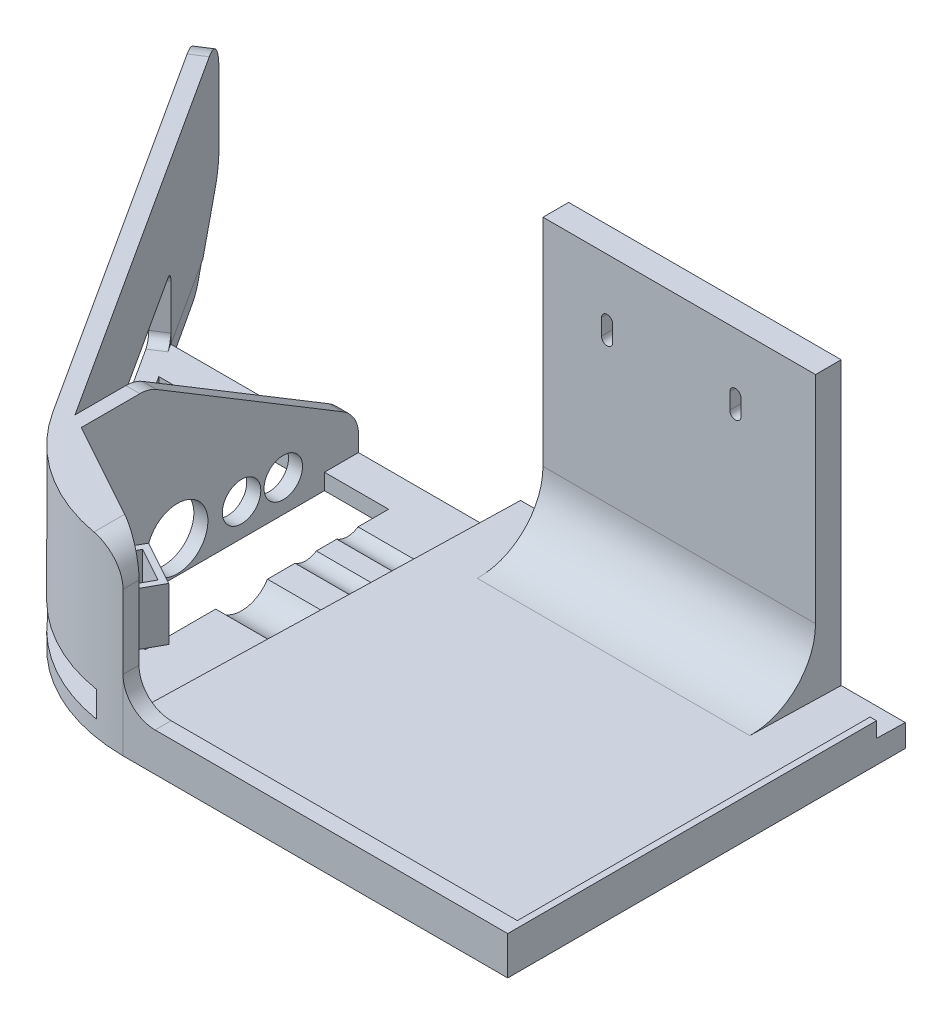
from build123d import *

# Parameters (mm, degrees)
SKETCH1_W            = 155
SKETCH1_H            = 5
BOSS_EXTRUDE2_DEPTH  = 55
SKETCH2_W            = 112
SKETCH2_H            = 45
SKETCH2_R            = 1.75
CUT_EXTRUDE1_DEPTH   = 55
SKETCH3_W            = 100
SKETCH3_H            = 20
CUT_EXTRUDE2_DEPTH   = 55
SKETCH4_W            = 40
SKETCH4_H            = 8.065867699
CUT_EXTRUDE3_DEPTH   = 55
BOSS_EXTRUDE4_DEPTH  = 5
CUT_EXTRUDE4_DEPTH   = 50
SKETCH9_W            = 4.377781836
SKETCH9_H            = 86.488706471
BOSS_EXTRUDE7_DEPTH  = 50
SKETCH10_W           = 20
SKETCH10_H           = 86.532324722
CUT_EXTRUDE5_DEPTH   = 10
SKETCH12_R           = 9.5
SKETCH12_R_2         = 6
CUT_EXTRUDE6_DEPTH   = 10
CUT_EXTRUDE7_START   = 50
SKETCH13_R           = 9.5
SKETCH13_R_2         = 6
CUT_EXTRUDE7_DEPTH   = 50
CUT_EXTRUDE8_DEPTH   = 50
CUT_EXTRUDE9_DEPTH   = 50
CUT_EXTRUDE10_DEPTH  = 10
FILLET5_R            = 3
SKETCH18_W           = 98.767816147
SKETCH18_H           = 10.604205858
BOSS_EXTRUDE8_DEPTH  = 5
CUT_EXTRUDE11_DEPTH  = 5
SKETCH20_W           = 155
SKETCH20_H           = 119
BOSS_EXTRUDE9_DEPTH  = 10
CUT_EXTRUDE13_DEPTH  = 155
SKETCH24_W           = 110
SKETCH24_H           = 8
BOSS_EXTRUDE10_DEPTH = 95
FILLET6_R            = 20
SKETCH26_W           = 16
SKETCH26_H           = 1.5
BOSS_EXTRUDE11_DEPTH = 12
BOSS_EXTRUDE12_DEPTH = 15
SKETCH28_R           = 2.5
CUT_EXTRUDE15_DEPTH  = 5
CUT_EXTRUDE17_DEPTH  = 35
SKETCH29_W           = 43
SKETCH29_H           = 43
CUT_EXTRUDE18_DEPTH  = 35
FILLET9_R            = 10
SKETCH31_W           = 124
SKETCH31_H           = 12
BOSS_EXTRUDE14_DEPTH = 2
SKETCH32_W           = 5
SKETCH32_H           = 2
BOSS_EXTRUDE15_DEPTH = 132
SKETCH33_W           = 20
SKETCH33_H           = 12
CUT_EXTRUDE19_DEPTH  = 160
SKETCH34_W           = 2
SKETCH34_H           = 12
BOSS_EXTRUDE17_DEPTH = 123
SKETCH36_R           = 6
CUT_EXTRUDE20_DEPTH  = 40
CUT_EXTRUDE21_DEPTH  = 25
SKETCH39_W           = 15
SKETCH39_H           = 12
CUT_EXTRUDE22_DEPTH  = 165
FILLET10_R           = 10
SKETCH40_W           = 2
SKETCH40_H           = 12
BOSS_EXTRUDE18_DEPTH = 115


with BuildPart() as part:
    # Sketch1 → Boss-Extrude2 (new body)
    with BuildSketch(Plane(origin=(0, 0, 0), x_dir=(1, 0, 0), z_dir=(0, 1, 0))):
        Polygon((-44.578450817, 29.59757322), (-48.782107146, 26.890310125), (-130, 153), (-125.796343671, 155.707263095), align=None)
        with BuildLine():
            ThreePointArc((0, 0), (-27.802696096, 7.256044178), (-48.782107146, 26.890310125))
            Line((-48.782107146, 26.890310125), (-44.578450817, 29.59757322))
            Line((-44.578450817, 29.59757322), (0, 5))
            Line((0, 5), (0, 0))
        make_face()
        with Locations((77.5, 2.5)):
            Rectangle(SKETCH1_W, SKETCH1_H)
    extrude(amount=BOSS_EXTRUDE2_DEPTH)

    # Sketch2 → Cut-Extrude1 (cut)
    with BuildSketch(Plane.XY):
        with Locations((99, 32.5)):
            Rectangle(SKETCH2_W, SKETCH2_H)
        with Locations((5, 25)):
            Circle(SKETCH2_R)
        with Locations((5, 50)):
            Circle(SKETCH2_R)
        with Locations((35, 50)):
            Circle(SKETCH2_R)
        with Locations((35, 25)):
            Circle(SKETCH2_R)
    extrude(amount=-CUT_EXTRUDE1_DEPTH, mode=Mode.SUBTRACT)

    # Sketch3 → Cut-Extrude2 (cut)
    with BuildSketch(Plane(origin=(-22.239707671, 0, 14.322945338), x_dir=(0.5414526190246729, 0, 0.840731265834287), z_dir=(-0.8407312658342869, 0, 0.5414526190246728))):
        with Locations((-99.020724146, 15)):
            Rectangle(SKETCH3_W, SKETCH3_H)
    extrude(amount=-CUT_EXTRUDE2_DEPTH, mode=Mode.SUBTRACT)

    # Sketch4 → Cut-Extrude3 (cut)
    with BuildSketch(Plane(origin=(2.114976352, 0, -3.832994761), x_dir=(-0.8755563671808256, 0, -0.48311597767939257), z_dir=(0.48311597767939257, 0, -0.8755563671808256))):
        with Locations((28.330006975, 9.03293385)):
            Rectangle(SKETCH4_W, SKETCH4_H)
    extrude(amount=-CUT_EXTRUDE3_DEPTH, mode=Mode.SUBTRACT)

    # Sketch5 → Boss-Extrude4 (add)
    with BuildSketch(Plane.XZ):
        Polygon((0, -5), (-44.578450817, -29.59757322), (-125.796343671, -155.707263095), (0, -155.707263095), align=None)
    extrude(amount=-BOSS_EXTRUDE4_DEPTH)

    # Sketch8 → Cut-Extrude4 (cut)
    with BuildSketch(Plane(origin=(0, 5, 0), x_dir=(1, 0, 0), z_dir=(0, 1, 0))):
        Polygon((-44.578450817, 29.59757322), (-98.72371272, 113.670699803), (-44.578450817, 113.670699803), align=None)
    extrude(amount=-CUT_EXTRUDE4_DEPTH, mode=Mode.SUBTRACT)

    # Sketch9 → Boss-Extrude7 (add)
    with BuildSketch(Plane(origin=(0, 5, 0), x_dir=(1, 0, 0), z_dir=(0, 1, 0))):
        with Locations((-42.389559899, 70.426346568)):
            Rectangle(SKETCH9_W, SKETCH9_H)
    extrude(amount=BOSS_EXTRUDE7_DEPTH)

    # Sketch10 → Cut-Extrude5 (cut)
    with BuildSketch(Plane(origin=(0, 5, 0), x_dir=(1, 0, 0), z_dir=(0, 1, 0))):
        with Locations((-30.200668981, 70.404537442)):
            Rectangle(SKETCH10_W, SKETCH10_H)
    extrude(amount=-CUT_EXTRUDE5_DEPTH, mode=Mode.SUBTRACT)

    # Sketch12 → Cut-Extrude6 (cut)
    with BuildSketch(Plane(origin=(-40.200668981, 0, 0), x_dir=(0, 0, -1), z_dir=(1, 0, 0))):
        with Locations(Location((57.181993332, 10, 0), (0, 0, 90))):
            Circle(SKETCH12_R)
        with Locations(Location((77.181993332, 10, 0), (0, 0, 90))):
            Circle(SKETCH12_R_2)
    extrude(amount=-CUT_EXTRUDE6_DEPTH, mode=Mode.SUBTRACT)

    # Sketch13 → Cut-Extrude7 (cut)
    with BuildSketch(Plane(origin=(-40.200668981, 0, 0), x_dir=(0, 0, -1), z_dir=(1, 0, 0)).offset(CUT_EXTRUDE7_START)):
        with Locations(Location((57.181993332, 10, 0), (0, 0, 90))):
            Circle(SKETCH13_R)
        with Locations(Location((77.181993332, 10, 0), (0, 0, 90))):
            Circle(SKETCH13_R_2)
    extrude(amount=-CUT_EXTRUDE7_DEPTH, mode=Mode.SUBTRACT)

    # Sketch14 → Cut-Extrude8 (cut)
    with BuildSketch(Plane(origin=(0, 5, 0), x_dir=(1, 0, 0), z_dir=(0, 1, 0))):
        Polygon((0, 103.038090201), (-91.876037903, 103.038090201), (-126.106254173, 155.707263095), (0, 155.707263095), align=None)
    extrude(amount=-CUT_EXTRUDE8_DEPTH, mode=Mode.SUBTRACT)

    # Sketch15 → Cut-Extrude9 (cut)
    with BuildSketch(Plane(origin=(-22.239707671, 0, 14.322945338), x_dir=(0.5414526190246729, 0, 0.840731265834287), z_dir=(-0.8407312658342869, 0, 0.5414526190246728))):
        Polygon((-176.035909688, 0), (-199.020724146, 18.247450711), (-199.020724146, 0), align=None)
    extrude(amount=-CUT_EXTRUDE9_DEPTH, mode=Mode.SUBTRACT)

    # Sketch16 → Cut-Extrude10 (cut)
    with BuildSketch(Plane(origin=(-40.200668981, 0, 0), x_dir=(0, 0, -1), z_dir=(1, 0, 0))):
        Polygon((113.670699803, 15.495236251), (48.252901996, 55), (113.670699803, 55), align=None)
    extrude(amount=-CUT_EXTRUDE10_DEPTH, mode=Mode.SUBTRACT)

    # Fillet5
    fillet5_edges = [part.edges().sort_by_distance(p)[0] for p in [
        (-100.847592598, 5, -112.302866383),
        (-46.680278982, 25, -28.243941672),
        (-46.680278982, 5, -28.243941672),
        (-100.825540884, 25, -112.317068256),
    ]]
    fillet(fillet5_edges, radius=FILLET5_R)

    # Sketch18 → Boss-Extrude8 (add)
    with BuildSketch(Plane(origin=(0, 5, 0), x_dir=(1, 0, 0), z_dir=(0, 1, 0))):
        with Locations((-49.383908074, 108.34019313)):
            Rectangle(SKETCH18_W, SKETCH18_H)
    extrude(amount=-BOSS_EXTRUDE8_DEPTH)

    # Sketch19 → Cut-Extrude11 (cut)
    with BuildSketch(Plane.XZ):
        Polygon((-97.82324149, -103.038090201), (-98.767816147, -104.504762295), (-98.767816147, -103.038090201), align=None)
    extrude(amount=-CUT_EXTRUDE11_DEPTH, mode=Mode.SUBTRACT)

    # Sketch20 → Boss-Extrude9 (add)
    with BuildSketch(Plane.XZ):
        with Locations((77.5, -64.5)):
            Rectangle(SKETCH20_W, SKETCH20_H)
    extrude(amount=-BOSS_EXTRUDE9_DEPTH)

    # Sketch21 → Cut-Extrude13 (cut)
    with BuildSketch(Plane(origin=(155, 0, 0), x_dir=(0, 0, -1), z_dir=(1, 0, 0))):
        Polygon((5, 10), (124, 10), (124, 7), align=None)
    extrude(amount=-CUT_EXTRUDE13_DEPTH, mode=Mode.SUBTRACT)

    # Sketch24 → Boss-Extrude10 (add)
    with BuildSketch(Plane.XZ):
        with Locations((70, -120)):
            Rectangle(SKETCH24_W, SKETCH24_H)
    extrude(amount=-BOSS_EXTRUDE10_DEPTH)

    # Fillet6
    fillet6_edges = [part.edges().sort_by_distance(p)[0] for p in [
        (70, 7.201680672, -116),
    ]]
    fillet(fillet6_edges, radius=FILLET6_R)

    # Sketch26 → Boss-Extrude11 (add)
    with BuildSketch(Plane(origin=(2.114976352, 0, -3.832994761), x_dir=(-0.8755563671808256, 0, -0.48311597767939257), z_dir=(0.48311597767939257, 0, -0.8755563671808256))):
        with Locations((28.330006975, 13.815867699)):
            Rectangle(SKETCH26_W, SKETCH26_H)
    extrude(amount=BOSS_EXTRUDE11_DEPTH)

    # Sketch27 → Boss-Extrude12 (add)
    with BuildSketch(Plane(origin=(0, 14.565867699, 0), x_dir=(1, 0, 0), z_dir=(0, 1, 0))):
        Polygon((-15.6850907, 13.654745957), (-9.887698968, 24.161422363), (-23.896600843, 31.891278006), (-29.693992575, 21.384601599), (-28.030435477, 20.466681242), (-23.150964103, 29.30980055), (-12.469176423, 23.415785623), (-17.348647798, 14.572666314), align=None)
    extrude(amount=BOSS_EXTRUDE12_DEPTH)

    # Sketch28 → Cut-Extrude15 (cut)
    with BuildSketch(Plane(origin=(0, 14.565867699, 0), x_dir=(1, 0, 0), z_dir=(0, 1, 0))):
        with Locations(Location((-20.24980595, 21.941233432, 0), (0, 0, 180))):
            Circle(SKETCH28_R)
    extrude(amount=-CUT_EXTRUDE15_DEPTH, mode=Mode.SUBTRACT)

    # Sketch25 → Cut-Extrude17 (cut)
    with BuildSketch(Plane(origin=(0, 0, -124), x_dir=(-1, 0, 0), z_dir=(0, 0, -1))):
        with BuildLine():
            Line((-36.75, 77), (-36.75, 72))
            ThreePointArc((-36.75, 72), (-35, 70.25), (-33.25, 72))
            Line((-33.25, 72), (-33.25, 77))
            ThreePointArc((-33.25, 77), (-35, 78.75), (-36.75, 77))
        make_face()
        with BuildLine():
            Line((-73.25, 77), (-73.25, 72))
            ThreePointArc((-73.25, 72), (-75, 70.25), (-76.75, 72))
            Line((-76.75, 72), (-76.75, 77))
            ThreePointArc((-76.75, 77), (-75, 78.75), (-73.25, 77))
        make_face()
    extrude(amount=-CUT_EXTRUDE17_DEPTH, mode=Mode.SUBTRACT)

    # Sketch29 → Cut-Extrude18 (cut)
    with BuildSketch(Plane.XY):
        with Locations((21.5, 33.5)):
            Rectangle(SKETCH29_W, SKETCH29_H)
    extrude(amount=-CUT_EXTRUDE18_DEPTH, mode=Mode.SUBTRACT)

    # Fillet9
    fillet9_edges = [part.edges().sort_by_distance(p)[0] for p in [
        (-115.522140631, 0, -134.985040643),
        (-127.898171835, 18.247450711, -154.353631548),
        (-42.389559899, 15.495236251, -113.670699803),
        (-42.389559899, 55, -48.252901996),
        (-127.898171835, 55, -154.353631548),
    ]]
    fillet(fillet9_edges, radius=FILLET9_R)

    # Sketch31 → Boss-Extrude14 (add)
    with BuildSketch(Plane(origin=(155, 0, 0), x_dir=(0, 0, -1), z_dir=(1, 0, 0))):
        with Locations((62, 6)):
            Rectangle(SKETCH31_W, SKETCH31_H)
    extrude(amount=-BOSS_EXTRUDE14_DEPTH)

    # Sketch32 → Boss-Extrude15 (add)
    with BuildSketch(Plane.ZY.offset(-153)):
        with Locations((-2.5, 11)):
            Rectangle(SKETCH32_W, SKETCH32_H)
    extrude(amount=BOSS_EXTRUDE15_DEPTH)

    # Sketch33 → Cut-Extrude19 (cut)
    with BuildSketch(Plane.XY):
        with Locations((145, 6)):
            Rectangle(SKETCH33_W, SKETCH33_H)
    extrude(amount=-CUT_EXTRUDE19_DEPTH, mode=Mode.SUBTRACT)

    # Sketch34 → Boss-Extrude17 (add)
    with BuildSketch(Plane.XY):
        with Locations((134, 6)):
            Rectangle(SKETCH34_W, SKETCH34_H)
    extrude(amount=-BOSS_EXTRUDE17_DEPTH)

    # Sketch36 → Cut-Extrude20 (cut, symmetric)
    with BuildSketch(Plane(origin=(-40.200668981, 0, 0), x_dir=(0, 0, -1), z_dir=(1, 0, 0))):
        with Locations(Location((90.194878088, 10, 0), (0, 0, 90))):
            Circle(SKETCH36_R)
    extrude(amount=CUT_EXTRUDE20_DEPTH, both=True, mode=Mode.SUBTRACT)

    # Sketch38 → Cut-Extrude21 (cut)
    with BuildSketch(Plane(origin=(125, 0, 0), x_dir=(0, 0, -1), z_dir=(1, 0, 0))):
        Polygon((95.495958465, 7.718589282), (124, 7), (124, 95), (116, 95), align=None)
    extrude(amount=-CUT_EXTRUDE21_DEPTH, mode=Mode.SUBTRACT)

    # Sketch39 → Cut-Extrude22 (cut)
    with BuildSketch(Plane.XY):
        with Locations((127.5, 6)):
            Rectangle(SKETCH39_W, SKETCH39_H)
    extrude(amount=-CUT_EXTRUDE22_DEPTH, mode=Mode.SUBTRACT)

    # Fillet10
    fillet10_edges = [part.edges().sort_by_distance(p)[0] for p in [
        (0, 12, -2.5),
        (0, 55, -2.5),
    ]]
    fillet(fillet10_edges, radius=FILLET10_R)

    # Sketch40 → Boss-Extrude18 (add)
    with BuildSketch(Plane.XY):
        with Locations((119, 6)):
            Rectangle(SKETCH40_W, SKETCH40_H)
    extrude(amount=-BOSS_EXTRUDE18_DEPTH)


solid = part.part
